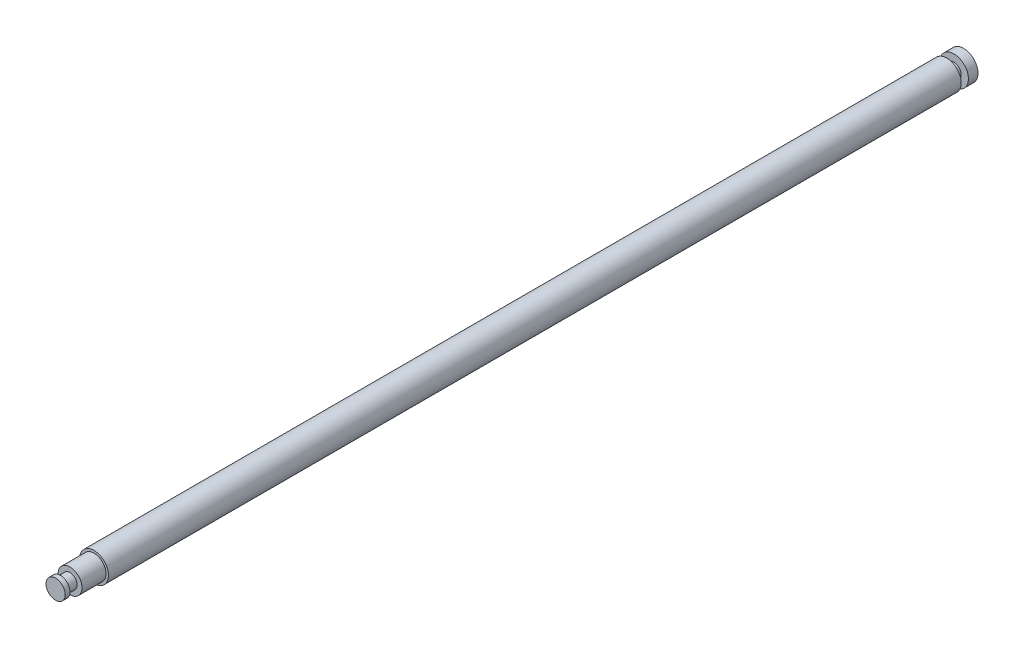
from build123d import *


with BuildPart() as part:
    # Croquis1 → Revolución1 (revolve)
    with BuildSketch(Plane(origin=(0, 0, 0), x_dir=(0, 0, -1), z_dir=(1, 0, 0)), mode=Mode.PRIVATE) as revoluci_n1_sk:
        Polygon((-94.5, 0), (-94.5, 2), (-93.5, 2), (-93.5, 1.5), (-91.5, 1.5), (-91.5, 2.5), (-86.5, 2.5), (-86.5, 3), (91, 3), (91, 1.5), (92.5, 1.5), (92.5, 3), (94.5, 3), (94.5, 0), align=None)
    revolve(revoluci_n1_sk.sketch.rotate(Axis((0, 0, 94.5), (0, 0, -1)), 90), axis=Axis((0, 0, 94.5), (0, 0, -1)))


solid = part.part
